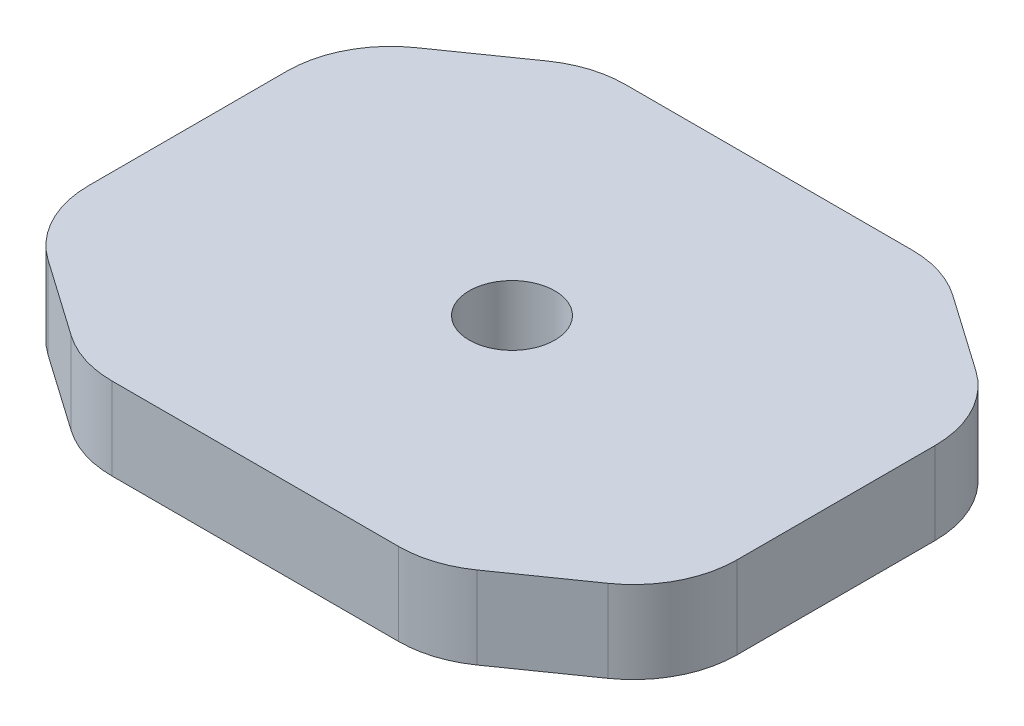
from build123d import *
from OCP.BRepFilletAPI import BRepFilletAPI_MakeChamfer

# Parameters (mm, degrees)
SKETCH2_W           = 25
SKETCH2_H           = 19.8
BOSS_EXTRUDE2_DEPTH = 3.175
SKETCH3_R           = 1.65
CUT_EXTRUDE1_DEPTH  = 3.175
CHAMFER1_SIZE       = 4
CHAMFER1_SIZE2      = 5.712592027
FILLET2_R           = 4


with BuildPart() as part:
    # Sketch2 → Boss-Extrude2 (new body)
    with BuildSketch(Plane(origin=(0, 0, 0), x_dir=(1, 0, 0), z_dir=(0, 1, 0))):
        Rectangle(SKETCH2_W, SKETCH2_H)
    extrude(amount=BOSS_EXTRUDE2_DEPTH)

    # Sketch3 → Cut-Extrude1 (cut)
    with BuildSketch(Plane(origin=(0, 3.175, 0), x_dir=(1, 0, 0), z_dir=(0, 1, 0))):
        with Locations(Location((0, 0, 0), (0, 0, 270))):
            Circle(SKETCH3_R)
    extrude(amount=-CUT_EXTRUDE1_DEPTH, mode=Mode.SUBTRACT)

    # Chamfer1: one chamfer whose edges measure the first distance from different faces: ONE call of the kernel's chamfer builder (chamfer() names one face for all edges)
    chamfer1_edges_1 = [part.edges().sort_by_distance(p)[0] for p in [
        (12.5, 1.5875, 9.9),
        (12.5, 1.5875, -9.9),
    ]]
    chamfer1_side_1 = [part.faces().sort_by_distance(p)[0] for p in [
        (12.5, 1.5875, 0),
    ]]
    chamfer1_edges_2 = [part.edges().sort_by_distance(p)[0] for p in [
        (-12.5, 1.5875, 9.9),
        (-12.5, 1.5875, -9.9),
    ]]
    chamfer1_side_2 = [part.faces().sort_by_distance(p)[0] for p in [
        (-12.5, 1.5875, 0),
    ]]
    chamfer1 = BRepFilletAPI_MakeChamfer(part.part.solid().wrapped)
    for e in chamfer1_edges_1:
        chamfer1.Add(CHAMFER1_SIZE, CHAMFER1_SIZE2, e.wrapped, chamfer1_side_1[0].wrapped)  # the first distance lies on this face
    for e in chamfer1_edges_2:
        chamfer1.Add(CHAMFER1_SIZE, CHAMFER1_SIZE2, e.wrapped, chamfer1_side_2[0].wrapped)  # the first distance lies on this face
    add(Compound.cast(chamfer1.Shape()), mode=Mode.REPLACE)

    # Fillet2
    fillet2_edges = [part.edges().sort_by_distance(p)[0] for p in [
        (12.5, 1.5875, -5.9),
        (12.5, 1.5875, 5.9),
        (-6.787407973, 1.5875, 9.9),
        (6.787407973, 1.5875, 9.9),
        (-12.5, 1.5875, -5.9),
        (-12.5, 1.5875, 5.9),
        (6.787407973, 1.5875, -9.9),
        (-6.787407973, 1.5875, -9.9),
    ]]
    fillet(fillet2_edges, radius=FILLET2_R)


solid = part.part
